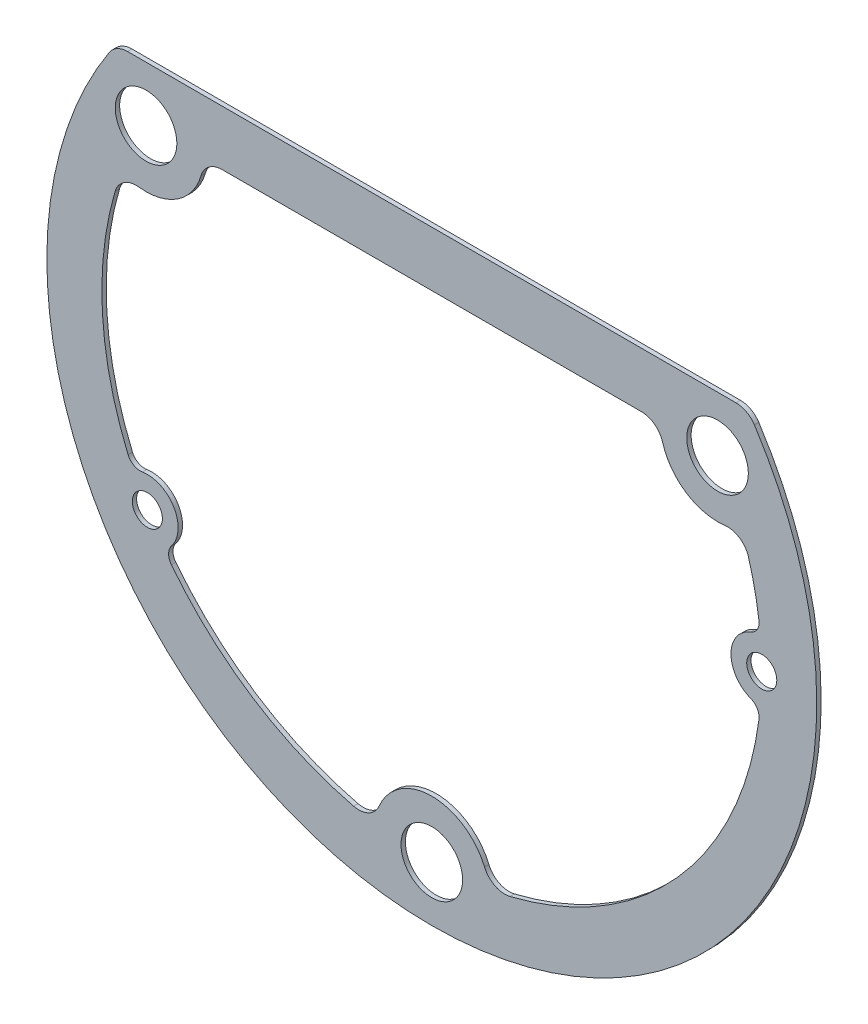
from build123d import *

# Parameters (mm, degrees)
SKETCH_1_R      = 7
EXTRUDE_1_DEPTH = 1
SKETCH_2_R      = 3.75
SKETCH_3_R      = 3
SKETCH_2_4_R    = 3.75
SKETCH_3_4_R    = 3


with BuildPart() as part:
    # Эскиз1 → Бобышка-Вытянуть1 (new body)
    with BuildSketch(Plane.XY):
        with BuildLine():
            Line((-69.14658343, 50), (69.14658343, 50))
            ThreePointArc((69.14658343, 50), (71.530239903, 49.395245365), (73.337285456, 47.727272727))
            ThreePointArc((73.337285456, 47.727272727), (0, -87.5), (-73.337285456, 47.727272727))
            ThreePointArc((-73.337285456, 47.727272727), (-71.530239903, 49.395245365), (-69.14658343, 50))
        make_face()
        with Locations((-64.95, 37.503299855)):
            Circle(SKETCH_1_R, mode=Mode.SUBTRACT)
        with Locations((64.95, 37.503299855)):
            Circle(SKETCH_1_R, mode=Mode.SUBTRACT)
        with Locations((0, -75)):
            Circle(SKETCH_1_R, mode=Mode.SUBTRACT)
        with BuildLine():
            Line((-47.658383534, 37.503299855), (47.658383534, 37.503299855))
            ThreePointArc((47.658383534, 37.503299855), (50.663009597, 36.499826124), (52.46161033, 33.892188744))
            ThreePointArc((52.46161033, 33.892188744), (57.800209242, 26.646021554), (66.56595151, 24.604125435))
            ThreePointArc((66.56595151, 24.604125435), (69.931223097, 23.822835867), (71.986576416, 21.045969112))
            ThreePointArc((71.986576416, 21.045969112), (73.39628095, 15.426793015), (74.368055556, 9.715570641))
            ThreePointArc((74.368055556, 9.715570641), (73.972679073, 7.794963627), (72.475333333, 6.528863471))
            ThreePointArc((72.475333333, 6.528863471), (68, 0), (72.475333333, -6.528863471))
            ThreePointArc((72.475333333, -6.528863471), (73.972679073, -7.794963627), (74.368055556, -9.715570641))
            ThreePointArc((74.368055556, -9.715570641), (55.850918931, -50.056716378), (17.770646228, -72.864285714))
            ThreePointArc((17.770646228, -72.864285714), (14.338112526, -72.472905294), (11.978731902, -69.949259259))
            ThreePointArc((11.978731902, -69.949259259), (0, -62), (-11.978731902, -69.949259259))
            ThreePointArc((-11.978731902, -69.949259259), (-14.338112526, -72.472905294), (-17.770646228, -72.864285714))
            ThreePointArc((-17.770646228, -72.864285714), (-40.749625279, -62.964021787), (-59.19327098, -46.056016661))
            ThreePointArc((-59.19327098, -46.056016661), (-59.825507849, -44.199856536), (-59.176073891, -42.349643196))
            ThreePointArc((-59.176073891, -42.349643196), (-58.625658395, -34.453333333), (-65.791988875, -31.092027915))
            ThreePointArc((-65.791988875, -31.092027915), (-67.724404324, -30.759124925), (-69.038382563, -29.303612969))
            ThreePointArc((-69.038382563, -29.303612969), (-74.871756142, -4.384077128), (-71.986576416, 21.045969112))
            ThreePointArc((-71.986576416, 21.045969112), (-69.931223097, 23.822835867), (-66.56595151, 24.604125435))
            ThreePointArc((-66.56595151, 24.604125435), (-57.800209242, 26.646021554), (-52.46161033, 33.892188744))
            ThreePointArc((-52.46161033, 33.892188744), (-50.663009597, 36.499826124), (-47.658383534, 37.503299855))
        make_face(mode=Mode.SUBTRACT)
    extrude(amount=EXTRUDE_1_DEPTH)

    # Эскиз2 → Вырез-По сечениям1 section 0
    with BuildSketch(Plane(origin=(0, 0, -18), x_dir=(-1, 0, 0), z_dir=(0, 0, -1))):
        with Locations((64.660652641, -38)):
            Circle(SKETCH_2_R)
    # Эскиз3 → Вырез-По сечениям1 section 1
    with BuildSketch(Plane.XY.offset(25)):
        with Locations((-64.660652641, -38)):
            Circle(SKETCH_3_R)
    loft(mode=Mode.SUBTRACT)

    # Эскиз2<4> → Вырез-По сечениям2 section 0
    with BuildSketch(Plane(origin=(0, 0, -18), x_dir=(-1, 0, 0), z_dir=(0, 0, -1))):
        with Locations((-75, 0)):
            Circle(SKETCH_2_4_R)
    # Эскиз3<4> → Вырез-По сечениям2 section 1
    with BuildSketch(Plane.XY.offset(25)):
        with Locations((75, 0)):
            Circle(SKETCH_3_4_R)
    loft(mode=Mode.SUBTRACT)


solid = part.part
